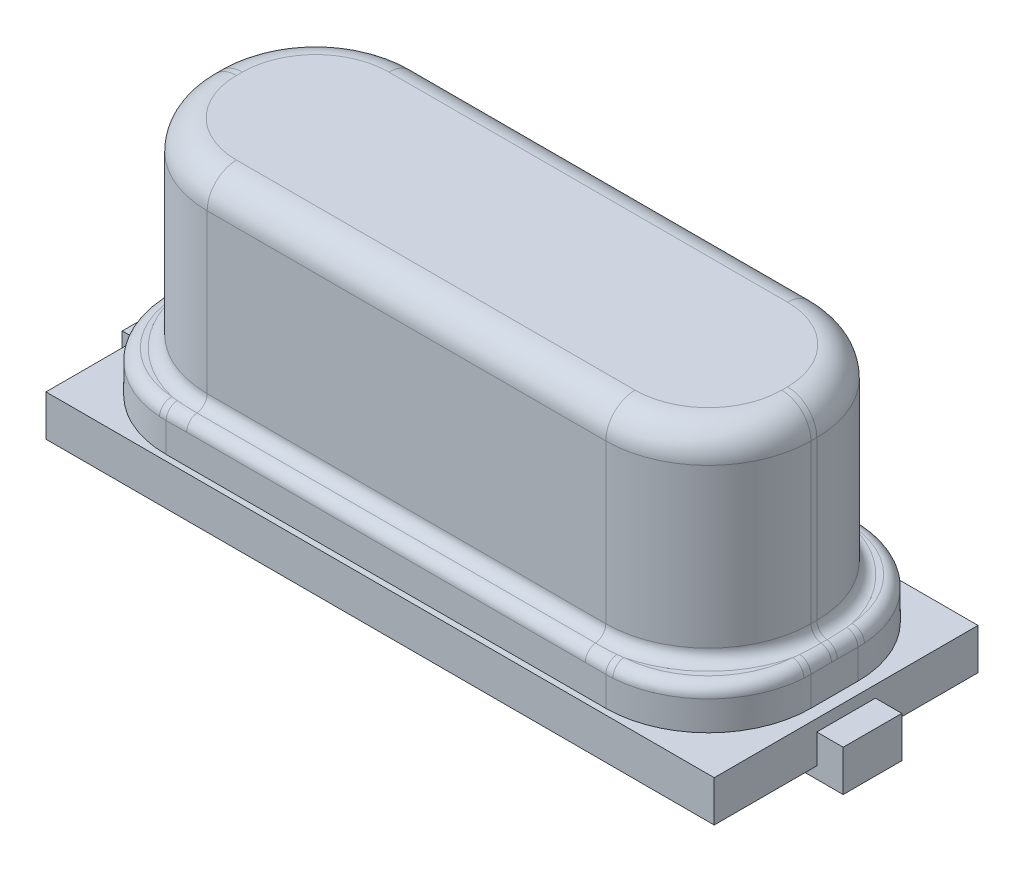
from build123d import *

# Parameters (mm, degrees)
SKETCH_1_W        = 3.15
SKETCH_1_H        = 1
EXTRUDE_1_DEPTH   = 0.7
EXTRUDE_1_2_DEPTH = 0.7
SKETCH_6_W        = 11.4
SKETCH_6_H        = 4.5
EXTRUDE_4_DEPTH   = 0.7
EXTRUDE_7_DEPTH   = 0.7
EXTRUDE_8_DEPTH   = 3.4
FILLET_4_R        = 0.5
FILLET_5_R        = 0.2
FILLET_6_R        = 0.2


with BuildPart() as part:
    # Эскиз1 → Бобышка-Вытянуть1 (new body)
    with BuildSketch(Plane(origin=(0, 0, 0), x_dir=(1, 0, 0), z_dir=(0, 1, 0))):
        with Locations((-4.575, 0)):
            Rectangle(SKETCH_1_W, SKETCH_1_H)
    extrude(amount=EXTRUDE_1_DEPTH)



with BuildPart() as body_2:
    # Эскиз1 → Extrude 1 2 (new body)
    with BuildSketch(Plane(origin=(0, 0, 0), x_dir=(1, 0, 0), z_dir=(0, 1, 0))):
        with Locations((4.575, 0)):
            Rectangle(SKETCH_1_W, SKETCH_1_H)
    extrude(amount=EXTRUDE_1_2_DEPTH)


with BuildPart() as part_1:
    add(part.part)

    add(body_2.part)  # Бобышка-Вытянуть4 merges body 2
    # Эскиз6 → Бобышка-Вытянуть4 (add)
    with BuildSketch(Plane(origin=(0, 0.2, 0), x_dir=(-1, 0, 0), z_dir=(0, -1, 0))):
        Rectangle(SKETCH_6_W, SKETCH_6_H)
    extrude(amount=-EXTRUDE_4_DEPTH)

    # Эскиз7 → Бобышка-Вытянуть7 (add)
    with BuildSketch(Plane(origin=(0, 0.9, 0), x_dir=(1, 0, 0), z_dir=(0, 1, 0))):
        with BuildLine():
            Line((-3.75, 2.15), (3.75, 2.15))
            ThreePointArc((3.75, 2.15), (4.987436867, 1.637436867), (5.5, 0.4))
            Line((5.5, 0.4), (5.5, -0.4))
            ThreePointArc((5.5, -0.4), (4.987436867, -1.637436867), (3.75, -2.15))
            Line((3.75, -2.15), (-3.75, -2.15))
            ThreePointArc((-3.75, -2.15), (-4.987436867, -1.637436867), (-5.5, -0.4))
            Line((-5.5, -0.4), (-5.5, 0.4))
            ThreePointArc((-5.5, 0.4), (-4.987436867, 1.637436867), (-3.75, 2.15))
        make_face()
    extrude(amount=EXTRUDE_7_DEPTH)

    # Эскиз9 → Бобышка-Вытянуть8 (add)
    with BuildSketch(Plane(origin=(0, 1.6, 0), x_dir=(1, 0, 0), z_dir=(0, 1, 0))):
        with BuildLine():
            Line((3.4, -1.8), (-3.4, -1.8))
            ThreePointArc((-3.4, -1.8), (-4.637436867, -1.287436867), (-5.15, -0.05))
            Line((-5.15, -0.05), (-5.15, 0.05))
            ThreePointArc((-5.15, 0.05), (-4.637436867, 1.287436867), (-3.4, 1.8))
            Line((-3.4, 1.8), (3.4, 1.8))
            ThreePointArc((3.4, 1.8), (4.637436867, 1.287436867), (5.15, 0.05))
            Line((5.15, 0.05), (5.15, -0.05))
            ThreePointArc((5.15, -0.05), (4.637436867, -1.287436867), (3.4, -1.8))
        make_face()
    extrude(amount=EXTRUDE_8_DEPTH)

    # Скругление4
    fillet_4_edges = [part_1.edges().sort_by_distance(p)[0] for p in [
        (4.637436867, 5, -1.287436867),
        (0, 5, -1.8),
        (-4.637436867, 5, -1.287436867),
        (-5.15, 5, 0),
        (-4.637436867, 5, 1.287436867),
        (0, 5, 1.8),
        (4.637436867, 5, 1.287436867),
        (5.15, 5, 0),
    ]]
    fillet(fillet_4_edges, radius=FILLET_4_R)

    # Скругление5
    fillet_5_edges = [part_1.edges().sort_by_distance(p)[0] for p in [
        (4.637436867, 1.6, -1.287436867),
        (0, 1.6, -1.8),
        (-4.637436867, 1.6, -1.287436867),
        (-5.15, 1.6, 0),
        (-4.637436867, 1.6, 1.287436867),
        (0, 1.6, 1.8),
        (4.637436867, 1.6, 1.287436867),
        (5.15, 1.6, 0),
    ]]
    fillet(fillet_5_edges, radius=FILLET_5_R)

    # Скругление6
    fillet_6_edges = [part_1.edges().sort_by_distance(p)[0] for p in [
        (-4.987436867, 1.6, 1.637436867),
        (-5.5, 1.6, 0),
        (-4.987436867, 1.6, -1.637436867),
        (0, 1.6, -2.15),
        (4.987436867, 1.6, -1.637436867),
        (5.5, 1.6, 0),
        (4.987436867, 1.6, 1.637436867),
        (0, 1.6, 2.15),
    ]]
    fillet(fillet_6_edges, radius=FILLET_6_R)


solid = part_1.part
